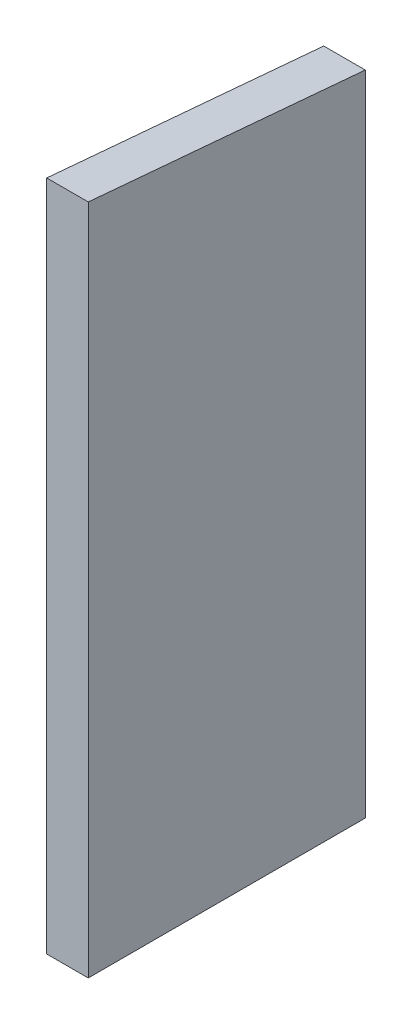
from build123d import *

# Parameters (mm, degrees)
CROQUIS1_W              = 15
CROQUIS1_H              = 100
SALIENTE_EXTRUIR1_DEPTH = 243.23
CORTAR_EXTRUIR1_DEPTH   = 249.768633272


with BuildPart() as part:
    # Croquis1 → Saliente-Extruir1 (new body)
    with BuildSketch(Plane(origin=(0, 0, 0), x_dir=(1, 0, 0), z_dir=(0, 1, 0))):
        Rectangle(CROQUIS1_W, CROQUIS1_H)
    extrude(amount=SALIENTE_EXTRUIR1_DEPTH)

    # Croquis2 → Cortar-Extruir1 (cut, through all)
    with BuildSketch(Plane(origin=(7.5, 0, 0), x_dir=(0, 0, -1), z_dir=(1, 0, 0))):
        Polygon((-50, 242.602035132), (50, 233.853168779), (50, 243.23), (-50, 243.23), align=None)
    extrude(amount=-CORTAR_EXTRUIR1_DEPTH, mode=Mode.SUBTRACT)


solid = part.part
